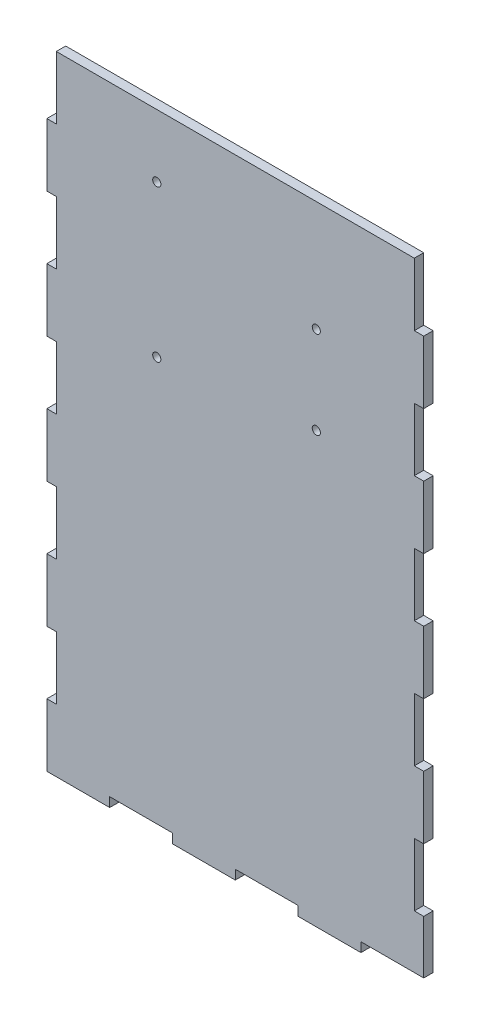
from build123d import *

# Parameters (mm, degrees)
SKETCH1_W           = 120
SKETCH1_H           = 200
SKETCH1_R           = 1.3
BOSS_EXTRUDE2_DEPTH = 3
SKETCH4_W           = 3
SKETCH4_H           = 20
CUT_EXTRUDE1_DEPTH  = 3
SKETCH5_W           = 3
SKETCH5_H           = 20
CUT_EXTRUDE2_DEPTH  = 3
SKETCH7_W           = 3
SKETCH7_H           = 20
CUT_EXTRUDE3_DEPTH  = 3
SKETCH8_W           = 3
SKETCH8_H           = 20
CUT_EXTRUDE4_DEPTH  = 3
SKETCH9_W           = 3
SKETCH9_H           = 20
CUT_EXTRUDE5_DEPTH  = 3
SKETCH11_W          = 3
SKETCH11_H          = 20
CUT_EXTRUDE7_DEPTH  = 3
SKETCH12_W          = 3
SKETCH12_H          = 20
CUT_EXTRUDE8_DEPTH  = 3
SKETCH13_W          = 3
SKETCH13_H          = 20
CUT_EXTRUDE9_DEPTH  = 3
SKETCH14_W          = 3
SKETCH14_H          = 20
CUT_EXTRUDE10_DEPTH = 3
SKETCH15_W          = 3
SKETCH15_H          = 20
CUT_EXTRUDE11_DEPTH = 3
SKETCH16_W          = 20
SKETCH16_H          = 3
CUT_EXTRUDE12_DEPTH = 3
SKETCH17_W          = 20
SKETCH17_H          = 3
CUT_EXTRUDE13_DEPTH = 3
SKETCH19_W          = 20
SKETCH19_H          = 3
CUT_EXTRUDE14_DEPTH = 3


with BuildPart() as part:
    # Sketch1 → Boss-Extrude2 (new body)
    with BuildSketch(Plane.XY):
        with Locations((-110, 50)):
            Rectangle(SKETCH1_W, SKETCH1_H)
        with Locations((-135, 130)):
            Circle(SKETCH1_R, mode=Mode.SUBTRACT)
        with Locations((-84.2, 114.8)):
            Circle(SKETCH1_R, mode=Mode.SUBTRACT)
        with Locations((-84.2, 86.9)):
            Circle(SKETCH1_R, mode=Mode.SUBTRACT)
        with Locations((-135, 81.7)):
            Circle(SKETCH1_R, mode=Mode.SUBTRACT)
    extrude(amount=BOSS_EXTRUDE2_DEPTH)

    # Sketch4 → Cut-Extrude1 (cut)
    with BuildSketch(Plane(origin=(-50, 0, 0), x_dir=(0, 0, -1), z_dir=(1, 0, 0))):
        with Locations((-1.5, 140)):
            Rectangle(SKETCH4_W, SKETCH4_H)
    extrude(amount=-CUT_EXTRUDE1_DEPTH, mode=Mode.SUBTRACT)

    # Sketch5 → Cut-Extrude2 (cut)
    with BuildSketch(Plane(origin=(-50, 0, 0), x_dir=(0, 0, -1), z_dir=(1, 0, 0))):
        with Locations((-1.5, 100)):
            Rectangle(SKETCH5_W, SKETCH5_H)
    extrude(amount=-CUT_EXTRUDE2_DEPTH, mode=Mode.SUBTRACT)

    # Sketch7 → Cut-Extrude3 (cut)
    with BuildSketch(Plane(origin=(-50, 0, 0), x_dir=(0, 0, -1), z_dir=(1, 0, 0))):
        with Locations((-1.5, 60)):
            Rectangle(SKETCH7_W, SKETCH7_H)
    extrude(amount=-CUT_EXTRUDE3_DEPTH, mode=Mode.SUBTRACT)

    # Sketch8 → Cut-Extrude4 (cut)
    with BuildSketch(Plane(origin=(-50, 0, 0), x_dir=(0, 0, -1), z_dir=(1, 0, 0))):
        with Locations((-1.5, 20)):
            Rectangle(SKETCH8_W, SKETCH8_H)
    extrude(amount=-CUT_EXTRUDE4_DEPTH, mode=Mode.SUBTRACT)

    # Sketch9 → Cut-Extrude5 (cut)
    with BuildSketch(Plane(origin=(-50, 0, 0), x_dir=(0, 0, -1), z_dir=(1, 0, 0))):
        with Locations((-1.5, -20)):
            Rectangle(SKETCH9_W, SKETCH9_H)
    extrude(amount=-CUT_EXTRUDE5_DEPTH, mode=Mode.SUBTRACT)

    # Sketch11 → Cut-Extrude7 (cut)
    with BuildSketch(Plane.ZY.offset(170)):
        with Locations((1.5, 140)):
            Rectangle(SKETCH11_W, SKETCH11_H)
    extrude(amount=-CUT_EXTRUDE7_DEPTH, mode=Mode.SUBTRACT)

    # Sketch12 → Cut-Extrude8 (cut)
    with BuildSketch(Plane.ZY.offset(170)):
        with Locations((1.5, 100)):
            Rectangle(SKETCH12_W, SKETCH12_H)
    extrude(amount=-CUT_EXTRUDE8_DEPTH, mode=Mode.SUBTRACT)

    # Sketch13 → Cut-Extrude9 (cut)
    with BuildSketch(Plane.ZY.offset(170)):
        with Locations((1.5, 60)):
            Rectangle(SKETCH13_W, SKETCH13_H)
    extrude(amount=-CUT_EXTRUDE9_DEPTH, mode=Mode.SUBTRACT)

    # Sketch14 → Cut-Extrude10 (cut)
    with BuildSketch(Plane.ZY.offset(170)):
        with Locations((1.5, 20)):
            Rectangle(SKETCH14_W, SKETCH14_H)
    extrude(amount=-CUT_EXTRUDE10_DEPTH, mode=Mode.SUBTRACT)

    # Sketch15 → Cut-Extrude11 (cut)
    with BuildSketch(Plane.ZY.offset(170)):
        with Locations((1.5, -20)):
            Rectangle(SKETCH15_W, SKETCH15_H)
    extrude(amount=-CUT_EXTRUDE11_DEPTH, mode=Mode.SUBTRACT)

    # Sketch16 → Cut-Extrude12 (cut)
    with BuildSketch(Plane(origin=(0, -50, 0), x_dir=(-1, 0, 0), z_dir=(0, -1, 0))):
        with Locations((60, -1.5)):
            Rectangle(SKETCH16_W, SKETCH16_H)
    extrude(amount=-CUT_EXTRUDE12_DEPTH, mode=Mode.SUBTRACT)

    # Sketch17 → Cut-Extrude13 (cut)
    with BuildSketch(Plane(origin=(0, -50, 0), x_dir=(-1, 0, 0), z_dir=(0, -1, 0))):
        with Locations((100, -1.5)):
            Rectangle(SKETCH17_W, SKETCH17_H)
    extrude(amount=-CUT_EXTRUDE13_DEPTH, mode=Mode.SUBTRACT)

    # Sketch19 → Cut-Extrude14 (cut)
    with BuildSketch(Plane(origin=(0, -50, 0), x_dir=(-1, 0, 0), z_dir=(0, -1, 0))):
        with Locations((140, -1.5)):
            Rectangle(SKETCH19_W, SKETCH19_H)
    extrude(amount=-CUT_EXTRUDE14_DEPTH, mode=Mode.SUBTRACT)


solid = part.part
